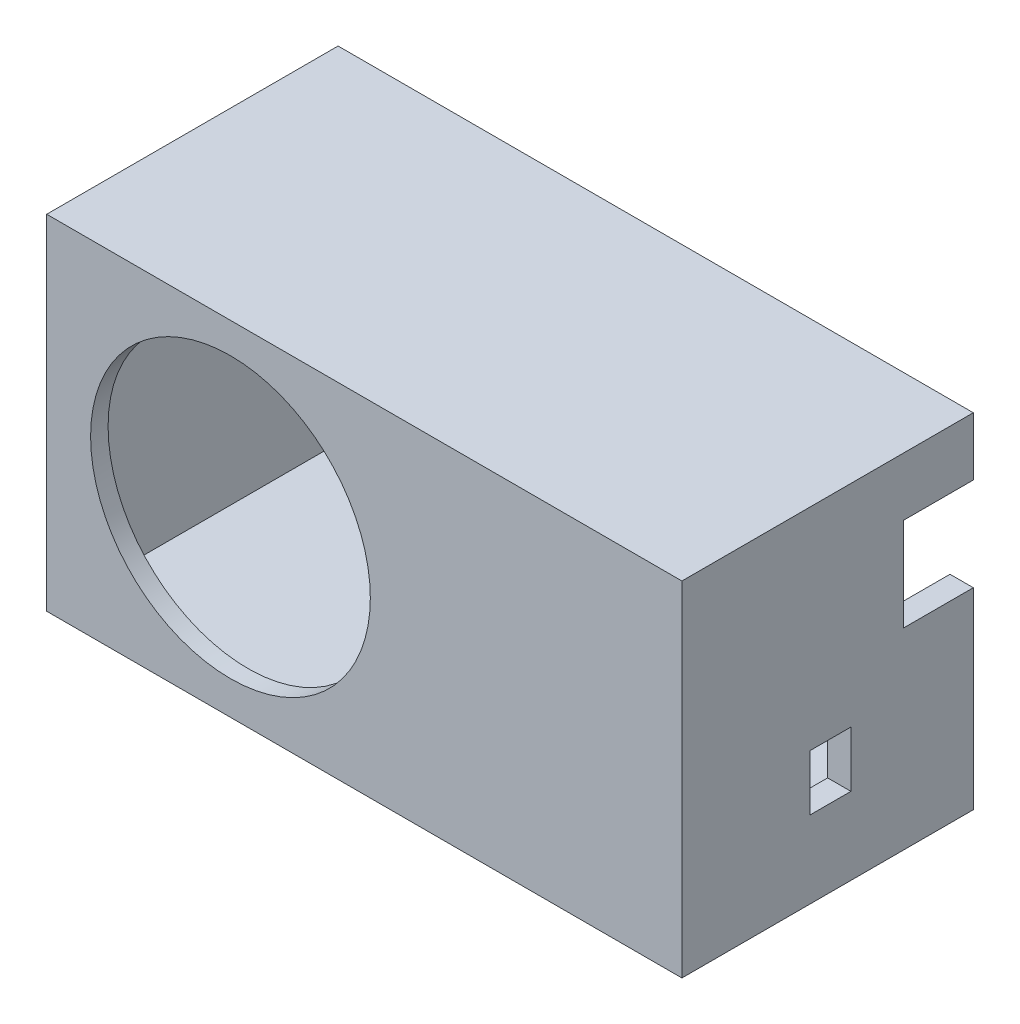
from build123d import *

# Parameters (mm, degrees)
ESQUISSE1_W                  = 109
ESQUISSE1_H                  = 59
BOSS_EXTRU_1_DEPTH           = 50
ESQUISSE2_W                  = 101
ESQUISSE2_H                  = 51
ENL_V_MAT_EXTRU_1_DEPTH      = 47
ENL_V_MAT_EXTRU_2_DEPTH      = 118.384292451
ENL_V_MAT_EXTRU_2_DEPTH_BACK = 21
ESQUISSE3_W                  = 7
ESQUISSE3_H                  = 9.559529104
ESQUISSE3_W_2                = 12
ESQUISSE3_H_2                = 16
ESQUISSE4_R                  = 24
ENL_V_MAT_EXTRU_3_DEPTH      = 73


with BuildPart() as part:
    # Esquisse1 → Boss.-Extru.1 (new body)
    with BuildSketch(Plane.XY):
        with Locations((-33.806693485, -29.5)):
            Rectangle(ESQUISSE1_W, ESQUISSE1_H)
    extrude(amount=BOSS_EXTRU_1_DEPTH)

    # Esquisse2 → Enlèv. mat.-Extru.1 (cut)
    with BuildSketch(Plane.XY):
        with Locations((-33.806693485, -29.5)):
            Rectangle(ESQUISSE2_W, ESQUISSE2_H)
    extrude(amount=ENL_V_MAT_EXTRU_1_DEPTH, mode=Mode.SUBTRACT)

    # Esquisse3 → Enlèv. mat.-Extru.2 (cut, two sides: drawn at the far end of the back side and taken through both)
    with BuildSketch(Plane(origin=(0, 0, 0), x_dir=(0, 0, -1), z_dir=(1, 0, 0)).offset(-ENL_V_MAT_EXTRU_2_DEPTH_BACK)):
        with Locations((-24.5, -40.983092888)):
            Rectangle(ESQUISSE3_W, ESQUISSE3_H)
        with Locations((-6, -18)):
            Rectangle(ESQUISSE3_W_2, ESQUISSE3_H_2)
    extrude(amount=ENL_V_MAT_EXTRU_2_DEPTH + ENL_V_MAT_EXTRU_2_DEPTH_BACK, mode=Mode.SUBTRACT)

    # Esquisse4 → Enlèv. mat.-Extru.3 (cut)
    with BuildSketch(Plane.XY):
        with Locations(Location((-56.773597779, -29.250359736, 0), (0, 0, 180))):
            Circle(ESQUISSE4_R)
    extrude(amount=ENL_V_MAT_EXTRU_3_DEPTH, mode=Mode.SUBTRACT)


solid = part.part
